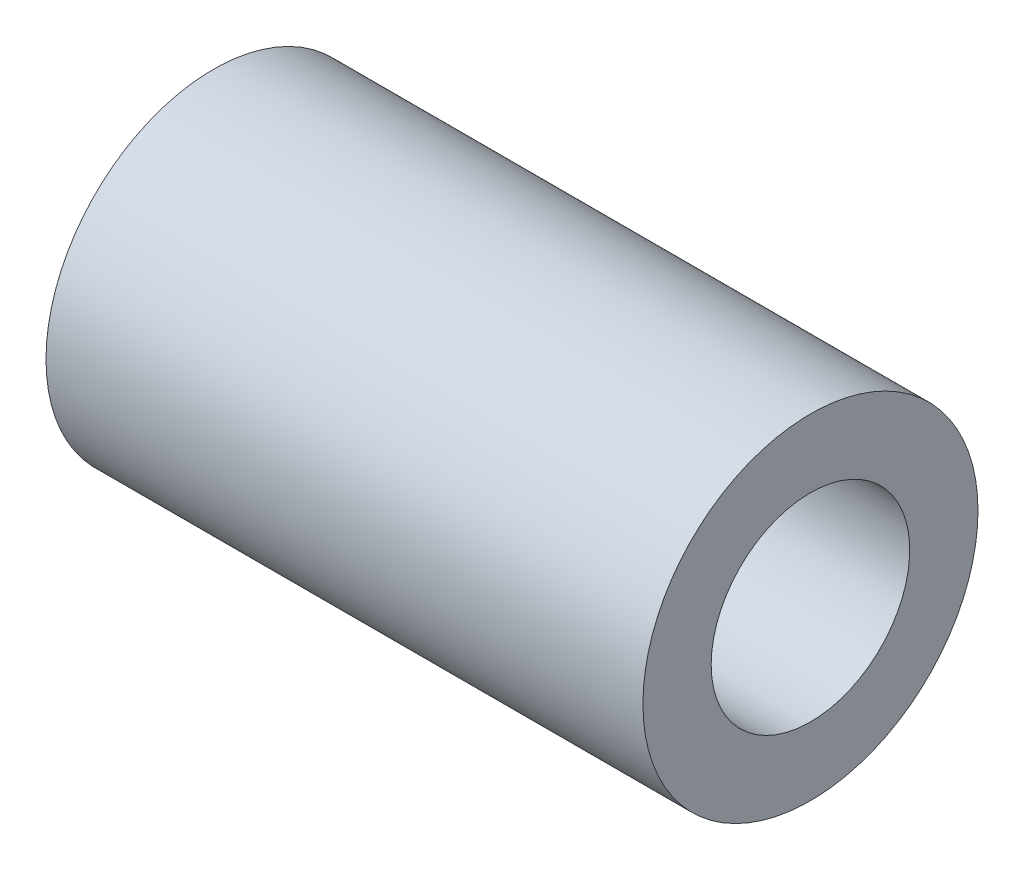
from build123d import *

# Parameters (mm, degrees)
SKETCH_1_R      = 27
SKETCH_1_R_2    = 16
EXTRUDE_1_DEPTH = 96.2


with BuildPart() as part:
    # 草图1 → 凸台-拉伸1 (new body)
    with BuildSketch(Plane(origin=(0, 0, 0), x_dir=(0, 0, -1), z_dir=(1, 0, 0))):
        with Locations(Location((0, 0, 0), (0, 0, 180))):
            Circle(SKETCH_1_R)
        with Locations(Location((0, 0, 0), (0, 0, 180))):
            Circle(SKETCH_1_R_2, mode=Mode.SUBTRACT)
    extrude(amount=EXTRUDE_1_DEPTH)


solid = part.part
